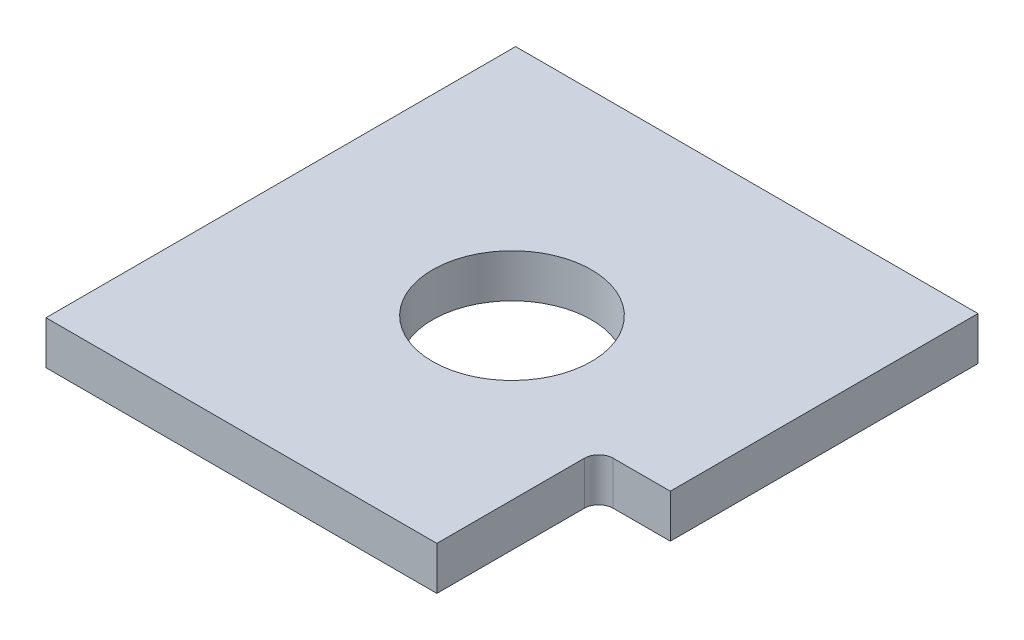
from build123d import *

# Parameters (mm, degrees)
SKETCH2_R           = 11
BOSS_EXTRUDE1_DEPTH = 6


with BuildPart() as part:
    # Sketch2 → Boss-Extrude1 (new body)
    with BuildSketch(Plane(origin=(0, 0, 0), x_dir=(1, 0, 0), z_dir=(0, 1, 0))):
        with BuildLine():
            Line((22.100000125, -32.5), (-31.999999875, -32.5))
            Line((-31.999999875, -32.5), (-31.999999875, 32.5))
            Line((-31.999999875, 32.5), (32.000000125, 32.5))
            Line((32.000000125, 32.5), (32.000000125, -10.08907026))
            Line((32.000000125, -10.08907026), (24.099999649, -10.08907026))
            ThreePointArc((24.099999649, -10.08907026), (22.685786394, -10.674856867), (22.100000125, -12.08907026))
            Line((22.100000125, -12.08907026), (22.100000125, -32.5))
        make_face()
        with Locations(Location((0, 0, 0), (0, 0, 270))):
            Circle(SKETCH2_R, mode=Mode.SUBTRACT)
    extrude(amount=BOSS_EXTRUDE1_DEPTH)


solid = part.part
